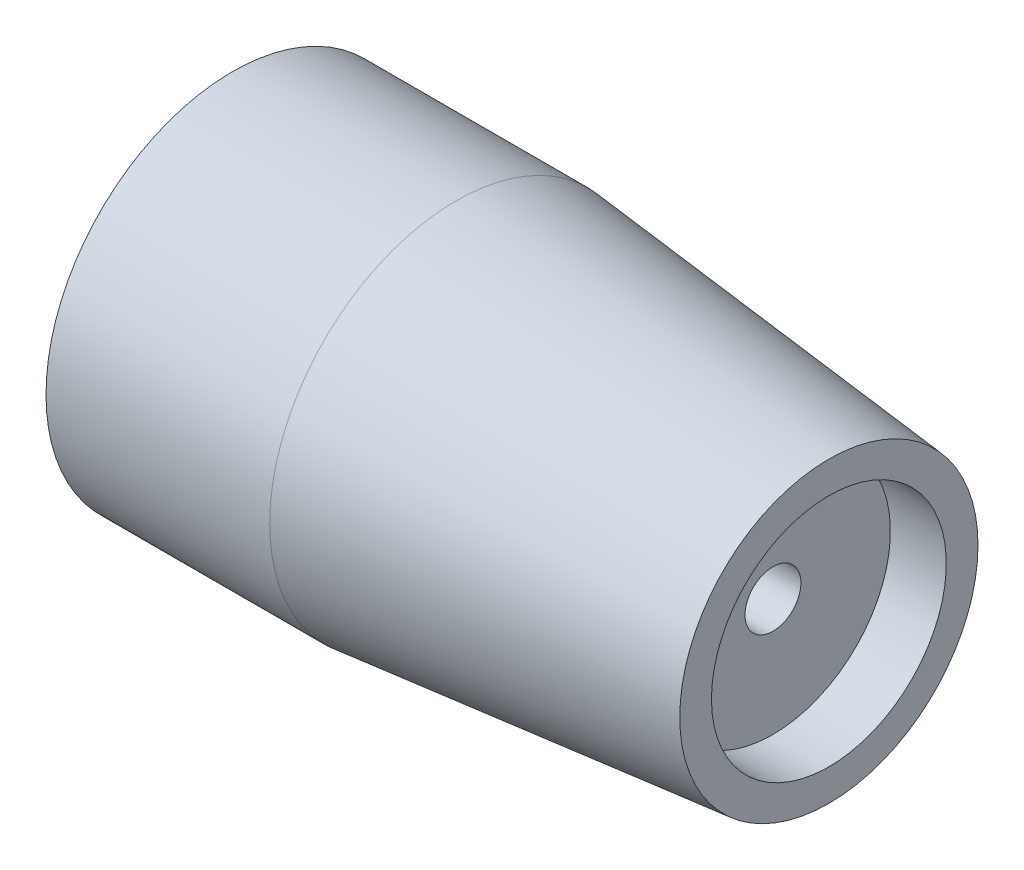
from build123d import *

# Parameters (mm, degrees)
SKIZZE2_R                       = 0.75
SCHNITT_LINEAR_AUSTRAGEN1_DEPTH = 17.132265805
AUFSATZ_LINEAR_START            = -0.2
SKIZZE3_R                       = 0.75
AUFSATZ_LINEAR_AUSTRAGEN1_DEPTH = 0.2


with BuildPart() as part:
    # Skizze1 → Rotation1 (revolve)
    with BuildSketch(Plane.XY, mode=Mode.PRIVATE) as rotation1_sk:
        Polygon((7.5, 0), (7.5, 3.15), (9, 3.15), (9, 4), (-1, 5), (-7, 5), (-7, 2.3), (0, 2.3), (0, 0), align=None)
    revolve(rotation1_sk.sketch.rotate(Axis((0, 0, 0), (1, 0, 0)), 90), axis=Axis((0, 0, 0), (1, 0, 0)))

    # Skizze2 → Schnitt-Linear austragen1 (cut, through all)
    with BuildSketch(Plane(origin=(7.5, 0, 0), x_dir=(0, 0, -1), z_dir=(1, 0, 0))):
        Circle(SKIZZE2_R)
    extrude(amount=-SCHNITT_LINEAR_AUSTRAGEN1_DEPTH, mode=Mode.SUBTRACT)

    # Skizze3 → Aufsatz-Linear austragen1 (add)
    with BuildSketch(Plane.ZY.offset(AUFSATZ_LINEAR_START)):
        with Locations(Location((0, 0, 0), (0, 0, 180))):
            Circle(SKIZZE3_R)
    extrude(amount=AUFSATZ_LINEAR_AUSTRAGEN1_DEPTH)


solid = part.part
